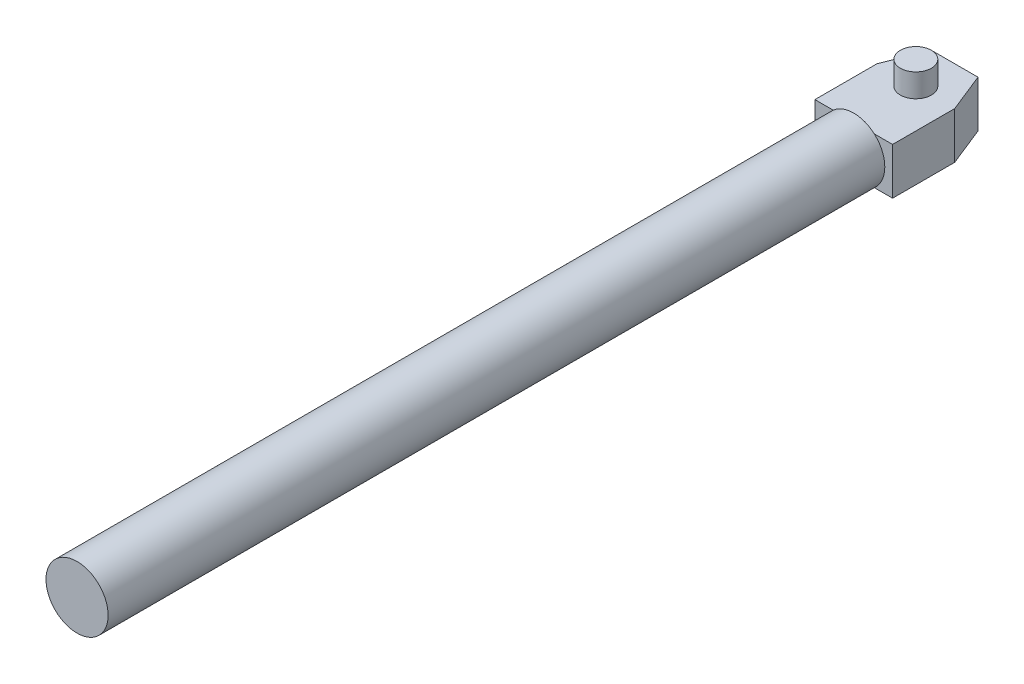
from build123d import *

# Parameters (mm, degrees)
SKETCH1_R           = 20
BOSS_EXTRUDE1_DEPTH = 500
BOSS_EXTRUDE2_DEPTH = 15
SKETCH4_R           = 10
BOSS_EXTRUDE3_DEPTH = 30


with BuildPart() as part:
    # Sketch1 → Boss-Extrude1 (new body)
    with BuildSketch(Plane.XY):
        Circle(SKETCH1_R)
    extrude(amount=BOSS_EXTRUDE1_DEPTH)

    # Sketch2 → Boss-Extrude2 (add, symmetric)
    with BuildSketch(Plane(origin=(0, 0, 0), x_dir=(1, 0, 0), z_dir=(0, 1, 0))):
        Polygon((-25, 40), (-15, 65), (15, 65), (25, 40), (25, 0), (-25, 0), align=None)
    extrude(amount=BOSS_EXTRUDE2_DEPTH, both=True)

    # Sketch4 → Boss-Extrude3 (add, symmetric)
    with BuildSketch(Plane(origin=(0, 0, 0), x_dir=(1, 0, 0), z_dir=(0, 1, 0))):
        with Locations(Location((0, 40, 0), (0, 0, 90))):
            Circle(SKETCH4_R)
    extrude(amount=BOSS_EXTRUDE3_DEPTH, both=True)


solid = part.part
